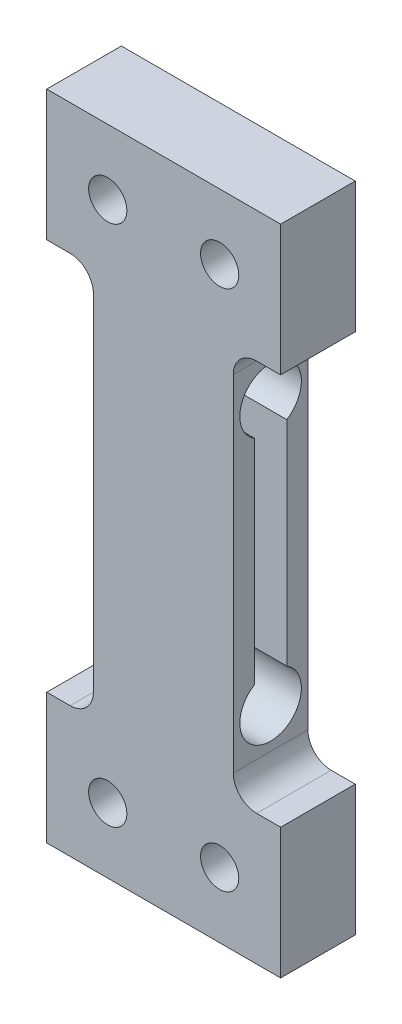
from build123d import *

# Parameters (mm, degrees)
SKETCH1_W                = 12.538434267
SKETCH1_H                = 35
BOSS_EXTRUDE1_DEPTH      = 4
SKETCH2_W                = 2.5
SKETCH2_H                = 21
CUT_EXTRUDE1_DEPTH       = 37.619666847
SKETCH3_W                = 2.538434267
SKETCH3_H                = 21
CUT_EXTRUDE2_DEPTH       = 37.619666847
CUT_EXTRUDE3_DEPTH       = 37.630181033
SKETCH5_W                = 7.5
SKETCH5_H                = 1.65
SKETCH6_W                = 7.5
SKETCH6_H                = 1.65
M2_5X0_45_TAPPED_HOLE1_D = 2.05
FILLET1_R                = 1.25


with BuildPart() as part:
    # Sketch1 → Boss-Extrude1 (new body)
    with BuildSketch(Plane.XY.offset(4)):
        with Locations((-3.730782867, 17.5)):
            Rectangle(SKETCH1_W, SKETCH1_H)
    extrude(amount=-BOSS_EXTRUDE1_DEPTH)

    # Sketch2 → Cut-Extrude1 (cut, through all)
    with BuildSketch(Plane(origin=(0, 0, 0), x_dir=(-1, 0, 0), z_dir=(0, 0, -1))):
        with Locations((8.75, 17.5)):
            Rectangle(SKETCH2_W, SKETCH2_H)
    extrude(amount=-CUT_EXTRUDE1_DEPTH, mode=Mode.SUBTRACT)

    # Sketch3 → Cut-Extrude2 (cut, through all)
    with BuildSketch(Plane(origin=(0, 0, 0), x_dir=(-1, 0, 0), z_dir=(0, 0, -1))):
        with Locations((-1.269217133, 17.5)):
            Rectangle(SKETCH3_W, SKETCH3_H)
    extrude(amount=-CUT_EXTRUDE2_DEPTH, mode=Mode.SUBTRACT)

    # Sketch4 → Cut-Extrude3 (cut, through all)
    with BuildSketch(Plane.ZY.offset(7.5)):
        with BuildLine():
            Line((2.855933763, 11.78563014), (2.855933763, 23.21436986))
            ThreePointArc((2.855933763, 23.21436986), (1.992824856, 22.975015601), (1.13183027, 23.221867319))
            Line((1.13183027, 23.221867319), (1.13183027, 11.778132681))
            ThreePointArc((1.13183027, 11.778132681), (1.992824856, 12.024984399), (2.855933763, 11.78563014))
        make_face()
    extrude(amount=-CUT_EXTRUDE3_DEPTH, mode=Mode.SUBTRACT)

    # Sketch5 → Cut-Revolve1 (revolve, cut)
    with BuildSketch(Plane(origin=(0, 0, 2), x_dir=(-1, 0, 0), z_dir=(0, 0, -1))):
        with Locations((3.75, 25.45)):
            Rectangle(SKETCH5_W, SKETCH5_H)
    revolve(axis=Axis((0, 24.625, 2), (-1, 0, 0)), mode=Mode.SUBTRACT)

    # Sketch6 → Cut-Revolve2 (revolve, cut)
    with BuildSketch(Plane(origin=(0, 0, 2), x_dir=(-1, 0, 0), z_dir=(0, 0, -1))):
        with Locations((3.75, 11.2)):
            Rectangle(SKETCH6_W, SKETCH6_H)
    revolve(axis=Axis((0, 10.375, 2), (-1, 0, 0)), mode=Mode.SUBTRACT)

    # M2.5x0.45 Tapped Hole1 (through all)
    with Locations(Plane.XY.offset(4)):
        with Locations((-0.730782866, 3.5), (-6.730782866, 3.5), (-0.730782866, 31.5), (-6.730782866, 31.5)):
            Hole(M2_5X0_45_TAPPED_HOLE1_D / 2)

    # Fillet1
    fillet1_edges = [part.edges().sort_by_distance(p)[0] for p in [
        (-7.5, 7, 2),
        (-7.5, 28, 2),
        (0, 28, 2),
        (0, 7, 2),
    ]]
    fillet(fillet1_edges, radius=FILLET1_R)


solid = part.part
